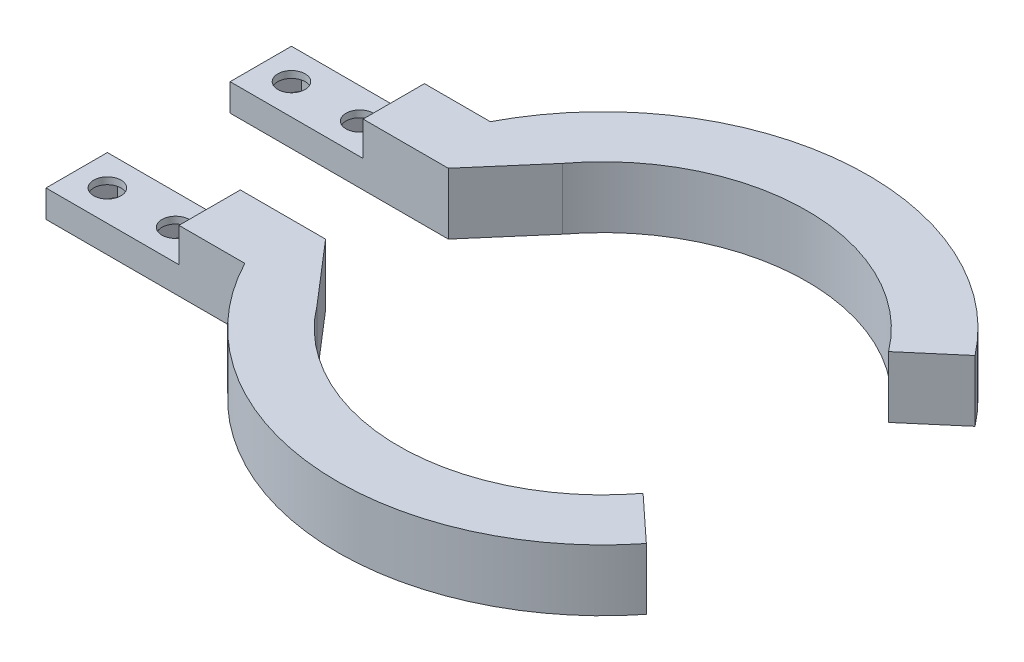
from build123d import *

# Parameters (mm, degrees)
SKETCH1_R           = 2
BOSS_EXTRUDE1_DEPTH = 9
SKETCH5_W           = 19.5
SKETCH5_H           = 36
CUT_EXTRUDE1_DEPTH  = 5
CUT_EXTRUDE2_DEPTH  = 3


with BuildPart() as part:
    # Sketch1 → Boss-Extrude1 (new body)
    # profile 1 of 4: a face of its own
    with BuildSketch(Plane(origin=(0, 0, 0), x_dir=(1, 0, 0), z_dir=(0, 1, 0))):
        Polygon((-31.6592752, 9), (-23.906136588, 18), (-34.498184555, 18), (-63.6592752, 18), (-63.6592752, 9), align=None)
        with Locations(Location((-59.1592752, 13.5, 0), (0, 0, 270))):
            Circle(SKETCH1_R, mode=Mode.SUBTRACT)
        with Locations(Location((-49.1592752, 13.5, 0), (0, 0, 270))):
            Circle(SKETCH1_R, mode=Mode.SUBTRACT)
    # profile 2 of 4: a face of its own
    with BuildSketch(Plane(origin=(0, 0, 0), x_dir=(1, 0, 0), z_dir=(0, 1, 0))):
        Polygon((-63.6592752, -18), (-34.498184555, -18), (-23.906136588, -18), (-31.6592752, -9), (-63.6592752, -9), align=None)
        with Locations(Location((-59.1592752, -13.5, 0), (0, 0, 270))):
            Circle(SKETCH1_R, mode=Mode.SUBTRACT)
        with Locations(Location((-49.1592752, -13.5, 0), (0, 0, 270))):
            Circle(SKETCH1_R, mode=Mode.SUBTRACT)
    # profile 3 of 4: a face of its own
    with BuildSketch(Plane(origin=(0, 0, 0), x_dir=(1, 0, 0), z_dir=(0, 1, 0))):
        with BuildLine():
            Line((23.906136588, 18), (30.747951295, 23.847184922))
            ThreePointArc((30.747951295, 23.847184922), (-3.473248516, 38.756435366), (-34.498184555, 18))
            Line((-34.498184555, 18), (-23.906136588, 18))
            ThreePointArc((-23.906136588, 18), (0, 29.924962265), (23.906136588, 18))
        make_face()
    # profile 4 of 4: a face of its own
    with BuildSketch(Plane(origin=(0, 0, 0), x_dir=(1, 0, 0), z_dir=(0, 1, 0))):
        with BuildLine():
            Line((-34.498184555, -18), (-23.906136588, -18))
            ThreePointArc((-23.906136588, -18), (0, -29.924962265), (23.906136588, -18))
            Line((23.906136588, -18), (30.521317527, -24.136567983))
            ThreePointArc((30.521317527, -24.136567983), (-3.656259631, -38.739598644), (-34.498184555, -18))
        make_face()
    extrude(amount=BOSS_EXTRUDE1_DEPTH)

    # Sketch5 → Cut-Extrude1 (cut)
    with BuildSketch(Plane(origin=(0, 9, 0), x_dir=(1, 0, 0), z_dir=(0, 1, 0))):
        with Locations((-53.9092752, 0)):
            Rectangle(SKETCH5_W, SKETCH5_H)
    extrude(amount=-CUT_EXTRUDE1_DEPTH, mode=Mode.SUBTRACT)

    # Sketch6 → Cut-Extrude2 (cut)
    with BuildSketch(Plane.XZ):
        Polygon((-57.109681744, 9.95), (-55.060088289, 13.5), (-57.109681744, 17.05), (-61.208868656, 17.05), (-63.258462111, 13.5), (-61.208868656, 9.95), align=None)
        Polygon((-47.109681744, 9.95), (-45.060088289, 13.5), (-47.109681744, 17.05), (-51.208868656, 17.05), (-53.258462111, 13.5), (-51.208868656, 9.95), align=None)
        Polygon((-61.208868656, -17.05), (-57.109681744, -17.05), (-55.060088289, -13.5), (-57.109681744, -9.95), (-61.208868656, -9.95), (-63.258462111, -13.5), align=None)
        Polygon((-47.109681744, -17.05), (-45.060088289, -13.5), (-47.109681744, -9.95), (-51.208868656, -9.95), (-53.258462111, -13.5), (-51.208868656, -17.05), align=None)
    extrude(amount=-CUT_EXTRUDE2_DEPTH, mode=Mode.SUBTRACT)


solid = part.part
